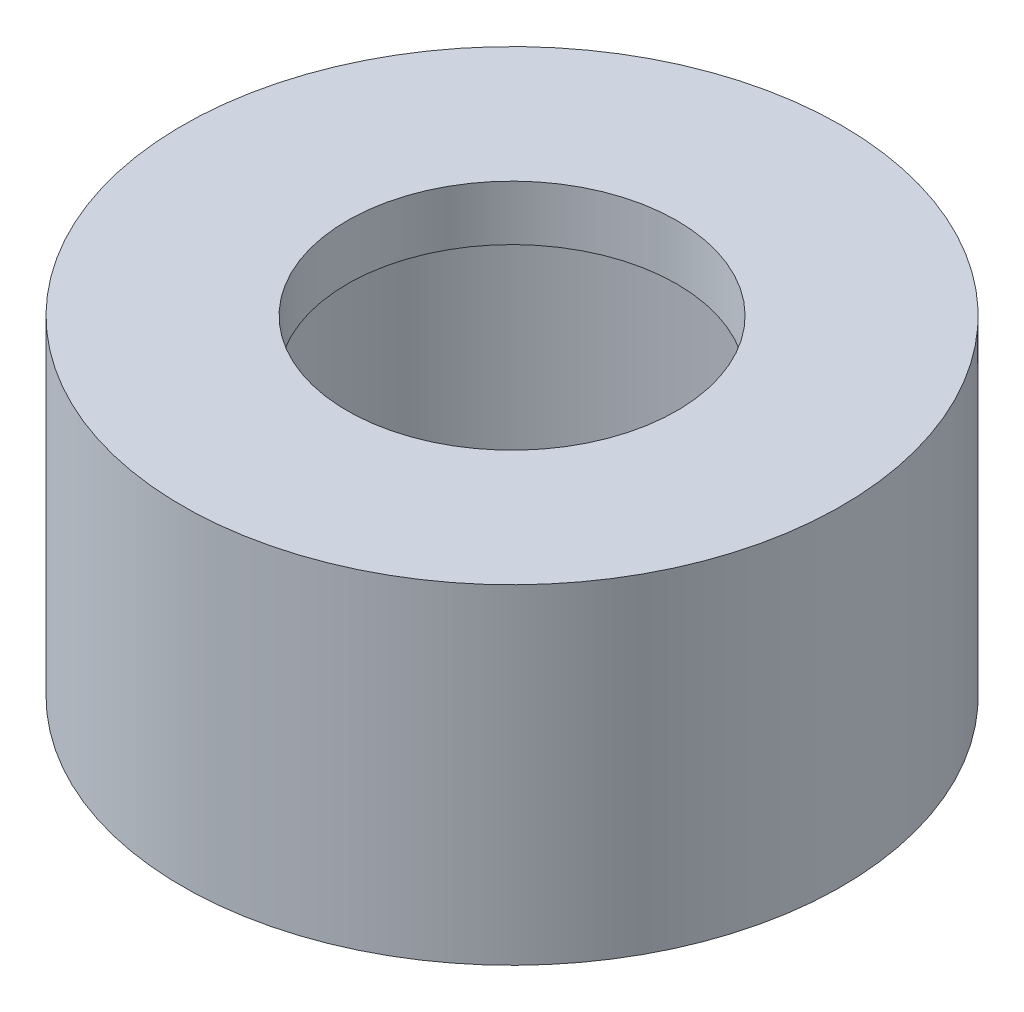
from build123d import *


with BuildPart() as part:
    # Sketch3 → Revolve1 (revolve)
    with BuildSketch(Plane.XY, mode=Mode.PRIVATE) as revolve1_sk:
        Polygon((-25, 0), (-30, 0), (-30, 30), (-15, 30), (-15, 25), (-25, 25), align=None)
    revolve(revolve1_sk.sketch.rotate(Axis((0, 0, 0), (0, 1, 0)), 270), axis=Axis((0, 0, 0), (0, 1, 0)))


solid = part.part
